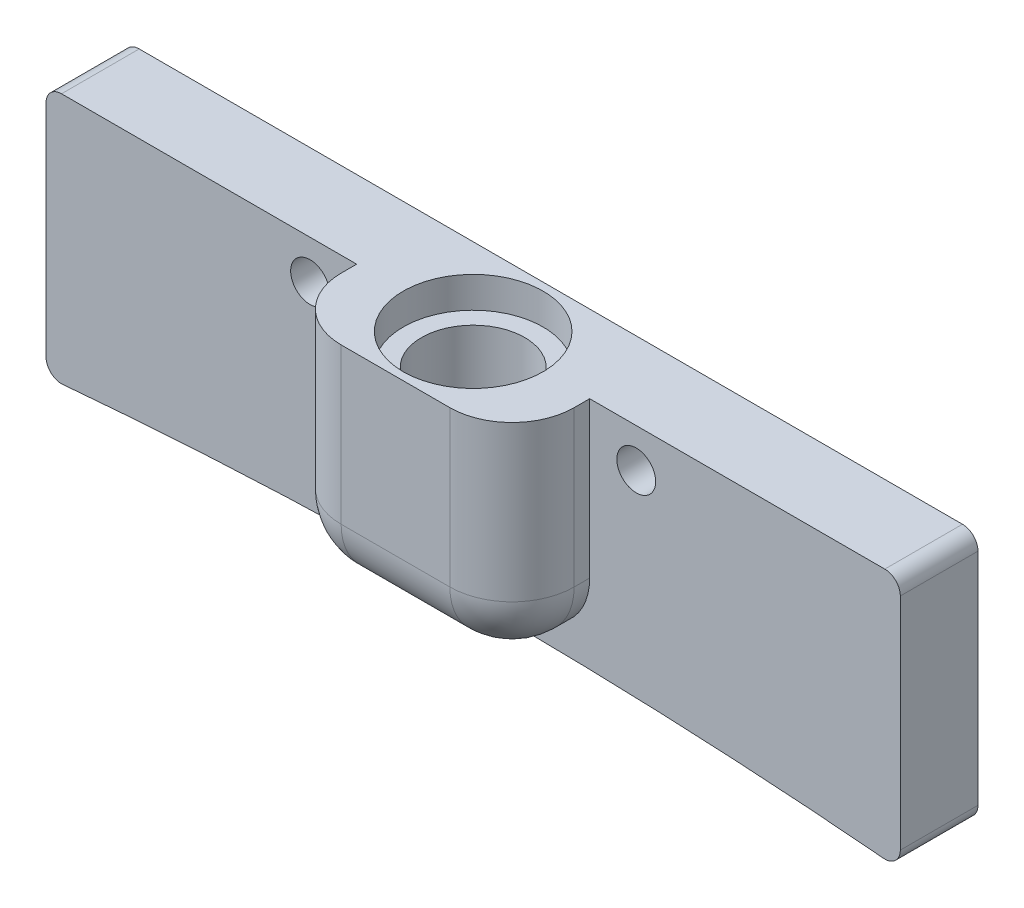
from build123d import *

# Parameters (mm, degrees)
BOSS_EXTRUDE1_DEPTH                     = 5
SKETCH4_W                               = 15
SKETCH4_H                               = 14
BOSS_EXTRUDE2_DEPTH                     = 5
CBORE_FOR_M6_HEX_HEAD_BOLT1_D           = 6.647
CBORE_FOR_M6_HEX_HEAD_BOLT1_DEPTH       = 10
CBORE_FOR_M6_HEX_HEAD_BOLT1_CBORE_D     = 9
CBORE_FOR_M6_HEX_HEAD_BOLT1_CBORE_DEPTH = 2
CBORE_FOR_M6_HEX_HEAD_BOLT1_TIP         = 1.996960267
FILLET1_R                               = 1
FILLET2_R                               = 4
M3X0_5_TAPPED_HOLE1_D                   = 2.5
M3X0_5_TAPPED_HOLE1_DEPTH               = 5
M3X0_5_TAPPED_HOLE1_TIP                 = 0.751075774


with BuildPart() as part:
    # Sketch1 → Boss-Extrude1 (new body)
    with BuildSketch(Plane(origin=(0, 0, 0), x_dir=(-1, 0, 0), z_dir=(0, 0, -1))):
        with BuildLine():
            Line((27.500000074, -16.263075607), (27.500000074, 0))
            Line((27.500000074, 0), (-27.5, 0))
            Line((-27.5, 0), (-27.5, -16.2630756))
            ThreePointArc((-27.5, -16.2630756), (3.7e-08, -15), (27.500000074, -16.263075607))
        make_face()
    extrude(amount=-BOSS_EXTRUDE1_DEPTH)

    # Sketch4 → Boss-Extrude2 (add)
    with BuildSketch(Plane.XY.offset(5)):
        with Locations((0, -7)):
            Rectangle(SKETCH4_W, SKETCH4_H)
    extrude(amount=BOSS_EXTRUDE2_DEPTH)

    # CBORE for M6 Hex Head Bolt1
    with Locations(Plane(origin=(0, 0, 0), x_dir=(1, 0, 0), z_dir=(0, 1, 0))):
        with Locations((0, -5)):
            CounterBoreHole(CBORE_FOR_M6_HEX_HEAD_BOLT1_D / 2, CBORE_FOR_M6_HEX_HEAD_BOLT1_CBORE_D / 2, CBORE_FOR_M6_HEX_HEAD_BOLT1_CBORE_DEPTH, depth=CBORE_FOR_M6_HEX_HEAD_BOLT1_DEPTH)
            with Locations((0, 0, -(CBORE_FOR_M6_HEX_HEAD_BOLT1_DEPTH + CBORE_FOR_M6_HEX_HEAD_BOLT1_TIP / 2))):  # 118° drill point
                Cone(0, CBORE_FOR_M6_HEX_HEAD_BOLT1_D / 2, CBORE_FOR_M6_HEX_HEAD_BOLT1_TIP, mode=Mode.SUBTRACT)

    # Fillet1
    fillet1_edges = [part.edges().sort_by_distance(p)[0] for p in [
        (27.5, 0, 2.5),
        (-27.500000074, 0, 2.5),
        (27.5, -16.2630756, 2.5),
        (-27.500000074, -16.263075607, 2.5),
    ]]
    fillet(fillet1_edges, radius=FILLET1_R)

    # Fillet2
    fillet2_edges = [part.edges().sort_by_distance(p)[0] for p in [
        (7.5, -14, 7.5),
        (7.5, -7, 10),
        (-7.5, -14, 7.5),
        (0, -14, 10),
        (-7.5, -7, 10),
    ]]
    fillet(fillet2_edges, radius=FILLET2_R)

    # M3x0.5 Tapped Hole1
    with Locations(Plane(origin=(-10.5, -2.5, 5), x_dir=(1, 0, 0), z_dir=(0, 0, 1))):
        with Locations((0, 0), (21, 0)):
            Hole(M3X0_5_TAPPED_HOLE1_D / 2, depth=M3X0_5_TAPPED_HOLE1_DEPTH)
            with Locations((0, 0, -(M3X0_5_TAPPED_HOLE1_DEPTH + M3X0_5_TAPPED_HOLE1_TIP / 2))):  # 118° drill point
                Cone(0, M3X0_5_TAPPED_HOLE1_D / 2, M3X0_5_TAPPED_HOLE1_TIP, mode=Mode.SUBTRACT)


solid = part.part
